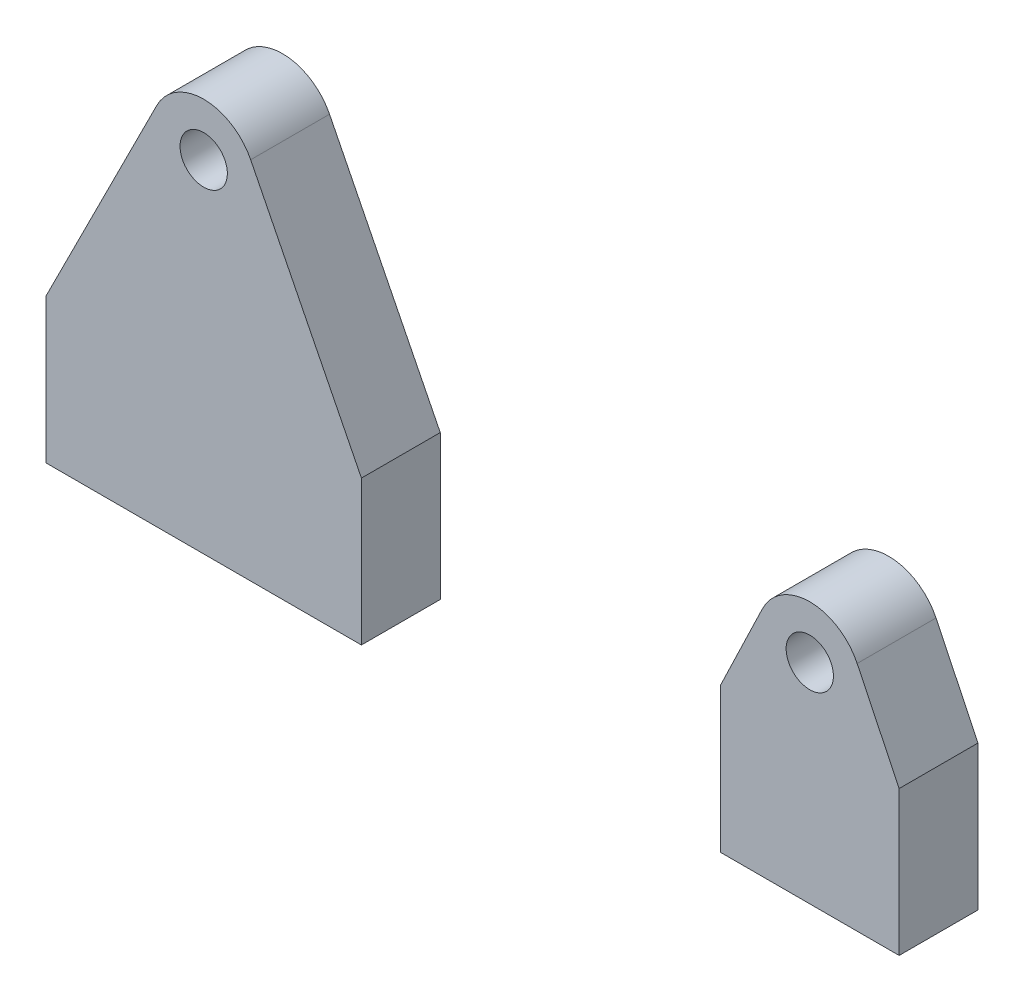
from build123d import *

# Parameters (mm, degrees)
SKETCH3_R           = 10
SKETCH3_W           = 34
SKETCH3_H           = 2.5
SKETCH3_H_2         = 25
SKETCH3_W_2         = 60
BOSS_EXTRUDE1_DEPTH = 15


with BuildPart() as part:
    # Sketch3 → Boss-Extrude1 (new body)
    # profile 1 of 8: a face of its own
    with BuildSketch(Plane(origin=(0, 0, -60), x_dir=(-1, 0, 0), z_dir=(0, 0, -1))):
        with BuildLine():
            Line((521.302714664, -553.340939136), (581.302714664, -553.340939136))
            Line((581.302714664, -553.340939136), (560.237622535, -511.429916687))
            ThreePointArc((560.237622535, -511.429916687), (561.032798905, -513.613035946), (561.302714664, -515.920731906))
            ThreePointArc((561.302714664, -515.920731906), (548.995018703, -525.650816148), (542.367806792, -511.429916687))
            Line((542.367806792, -511.429916687), (521.302714664, -553.340939136))
        make_face()
    # profile 2 of 8: a face of its own
    with BuildSketch(Plane(origin=(0, 0, -60), x_dir=(-1, 0, 0), z_dir=(0, 0, -1))):
        with Locations((551.302714664, -515.920731906)):
            Circle(SKETCH3_R)
        with BuildLine():
            add(Edge.make_bspline(
                [(555.699368258, -514.961859042), (553.78162253, -506.168551853), (544.98831534, -508.086297582), (546.906061069, -516.879604771), (548.823806798, -525.67291196), (557.617113987, -523.755166231), (555.699368258, -514.961859042)],
                knots=[0, 0, 0, 0, 0.5, 0.5, 0.5, 1, 1, 1, 1], degree=3, weights=[1, 0.333333333, 0.333333333, 1, 0.333333333, 0.333333333, 1]))
        make_face(mode=Mode.SUBTRACT)
    # profile 3 of 8: a face of its own
    with BuildSketch(Plane(origin=(0, 0, -60), x_dir=(-1, 0, 0), z_dir=(0, 0, -1))):
        with Locations((436.012687074, -541.064646672)):
            Circle(SKETCH3_R)
        with BuildLine():
            add(Edge.make_bspline(
                [(440.409340668, -540.105773808), (438.49159494, -531.312466619), (429.698287751, -533.230212348), (431.616033479, -542.023519537), (433.533779208, -550.816826726), (442.327086397, -548.899080997), (440.409340668, -540.105773808)],
                knots=[0, 0, 0, 0, 0.5, 0.5, 0.5, 1, 1, 1, 1], degree=3, weights=[1, 0.333333333, 0.333333333, 1, 0.333333333, 0.333333333, 1]))
        make_face(mode=Mode.SUBTRACT)
    # profile 4 of 8: a face of its own
    with BuildSketch(Plane(origin=(0, 0, -60), x_dir=(-1, 0, 0), z_dir=(0, 0, -1))):
        with BuildLine():
            Line((419.012687074, -553.340939136), (453.012687074, -553.340939136))
            Line((453.012687074, -553.340939136), (445.024731197, -536.730703811))
            ThreePointArc((445.024731197, -536.730703811), (445.762570182, -538.842085225), (446.012687074, -541.064646672))
            ThreePointArc((446.012687074, -541.064646672), (433.790125627, -550.81452978), (427.000642951, -536.730703811))
            Line((427.000642951, -536.730703811), (419.012687074, -553.340939136))
        make_face()
    # profile 5 of 8: a face of its own
    with BuildSketch(Plane(origin=(0, 0, -60), x_dir=(-1, 0, 0), z_dir=(0, 0, -1))):
        with Locations((436.012687074, -554.590939136)):
            Rectangle(SKETCH3_W, SKETCH3_H)
    # profile 6 of 8: a face of its own
    with BuildSketch(Plane(origin=(0, 0, -60), x_dir=(-1, 0, 0), z_dir=(0, 0, -1))):
        with Locations((436.012687074, -568.340939136)):
            Rectangle(SKETCH3_W, SKETCH3_H_2)
    # profile 7 of 8: a face of its own
    with BuildSketch(Plane(origin=(0, 0, -60), x_dir=(-1, 0, 0), z_dir=(0, 0, -1))):
        with Locations((551.302714664, -554.590939136)):
            Rectangle(SKETCH3_W_2, SKETCH3_H)
    # profile 8 of 8: a face of its own
    with BuildSketch(Plane(origin=(0, 0, -60), x_dir=(-1, 0, 0), z_dir=(0, 0, -1))):
        with Locations((551.302714664, -568.340939136)):
            Rectangle(SKETCH3_W_2, SKETCH3_H_2)
    extrude(amount=BOSS_EXTRUDE1_DEPTH)


solid = part.part
